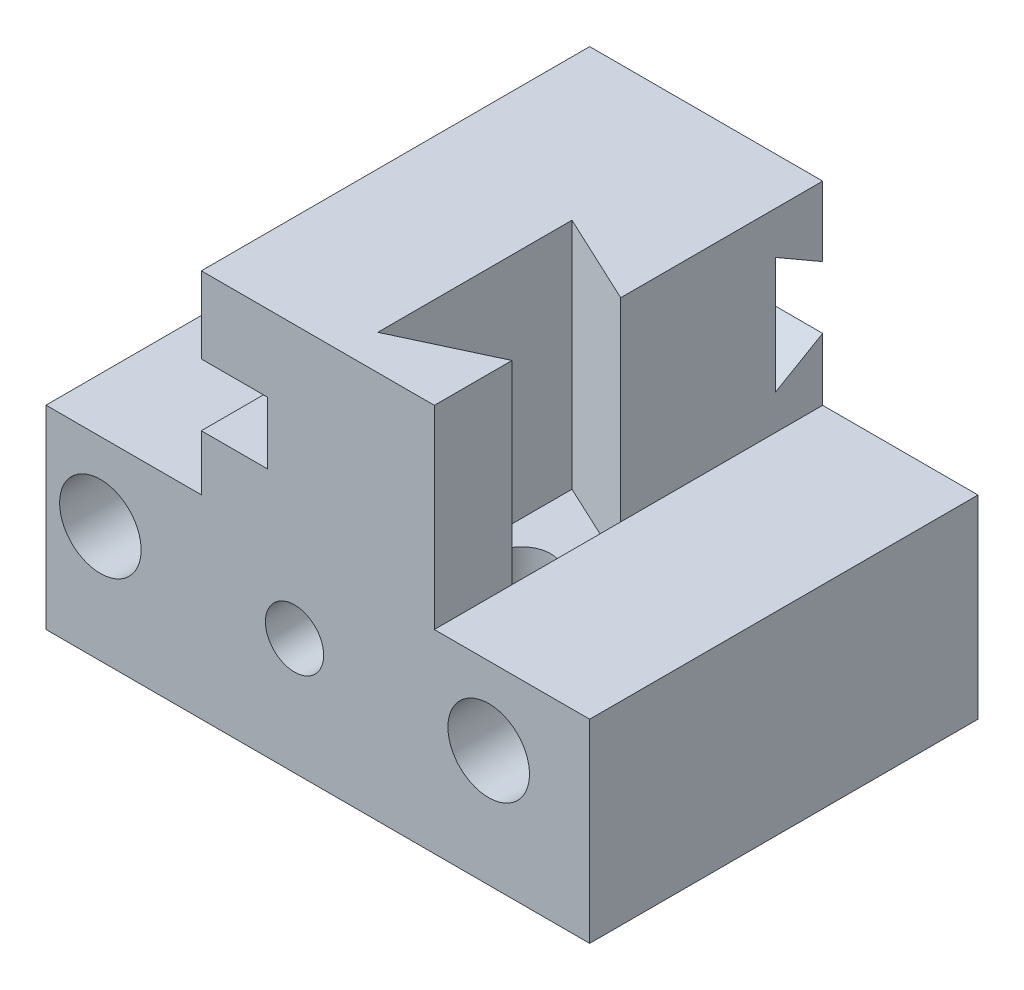
from build123d import *

# Parameters (mm, degrees)
SKETCH1_W                = 7
SKETCH1_H                = 5
BOSS_EXTRUDE1_DEPTH      = 5
HOLE1_D                  = 1.05
HOLE1_CBORE_D            = 1.3
HOLE1_CBORE_DEPTH        = 1.2
SKETCH20_W               = 5
SKETCH20_H               = 2.5
CUT_EXTRUDE11_DEPTH      = 2
M1_0X0_25_TAPPED_HOLE1_D = 0.75
SKETCH37_W               = 5
SKETCH37_H               = 2.5
CUT_EXTRUDE13_DEPTH      = 2
CUT_EXTRUDE15_DEPTH      = 3
CUT_EXTRUDE16_DEPTH      = 9.124038405
SKETCH45_R               = 0.375
CUT_EXTRUDE18_DEPTH      = 0.5
SKETCH44_W               = 0.852349788
SKETCH44_H               = 0.8
CUT_EXTRUDE19_DEPTH      = 4.5


with BuildPart() as part:
    # Sketch1 → Boss-Extrude1 (new body)
    with BuildSketch(Plane(origin=(0, 4, 0), x_dir=(-1, 0, 0), z_dir=(0, 1, 0))):
        with Locations((-3.5, 2.5)):
            Rectangle(SKETCH1_W, SKETCH1_H)
    extrude(amount=-BOSS_EXTRUDE1_DEPTH)

    # Hole1 (through all)
    with Locations(Plane(origin=(0, 0, 0), x_dir=(-1, 0, 0), z_dir=(0, 0, -1))):
        with Locations((-5.7, 0.5), (-0.7, 0.5)):
            CounterBoreHole(HOLE1_D / 2, HOLE1_CBORE_D / 2, HOLE1_CBORE_DEPTH)

    # Sketch20 → Cut-Extrude11 (cut)
    with BuildSketch(Plane(origin=(7, 0, 0), x_dir=(0, 0, -1), z_dir=(1, 0, 0))):
        with Locations((-2.5, 2.75)):
            Rectangle(SKETCH20_W, SKETCH20_H)
    extrude(amount=-CUT_EXTRUDE11_DEPTH, mode=Mode.SUBTRACT)

    # M1.0x0.25 Tapped Hole1 (through all)
    with Locations(Plane(origin=(0, 0, 0), x_dir=(-1, 0, 0), z_dir=(0, 0, -1))):
        with Locations((-3.2, 0.5)):
            Hole(M1_0X0_25_TAPPED_HOLE1_D / 2)

    # Sketch37 → Cut-Extrude13 (cut)
    with BuildSketch(Plane.ZY):
        with Locations((2.5, 2.752068207)):
            Rectangle(SKETCH37_W, SKETCH37_H)
    extrude(amount=-CUT_EXTRUDE13_DEPTH, mode=Mode.SUBTRACT)

    # Sketch41 → Cut-Extrude15 (cut)
    with BuildSketch(Plane(origin=(0, 4, 0), x_dir=(1, 0, 0), z_dir=(0, 1, 0))):
        Polygon((5, -2.6), (3.822078101, -2.05), (3.822078101, -4.55), (5, -4), align=None)
    extrude(amount=-CUT_EXTRUDE15_DEPTH, mode=Mode.SUBTRACT)

    # Sketch43 → Cut-Extrude16 (cut, through all)
    with BuildSketch(Plane.ZY.offset(-2)):
        Polygon((0, 2.302068207), (0.606217783, 1.952068207), (0.606217783, 3.452068207), (0, 3.102068207), align=None)
    extrude(amount=-CUT_EXTRUDE16_DEPTH, mode=Mode.SUBTRACT)

    # Sketch45 → Cut-Extrude18 (cut)
    with BuildSketch(Plane(origin=(0, 1, 0), x_dir=(1, 0, 0), z_dir=(0, 1, 0))):
        with Locations(Location((4.404643106, -3.280769975, 0), (0, 0, 270))):
            Circle(SKETCH45_R)
    extrude(amount=-CUT_EXTRUDE18_DEPTH, mode=Mode.SUBTRACT)

    # Sketch44 → Cut-Extrude19 (cut)
    with BuildSketch(Plane(origin=(0, 0, 0.606217783), x_dir=(-1, 0, 0), z_dir=(0, 0, -1))):
        with Locations((-2.426174894, 2.616682439)):
            Rectangle(SKETCH44_W, SKETCH44_H)
    extrude(amount=-CUT_EXTRUDE19_DEPTH, mode=Mode.SUBTRACT)


solid = part.part
